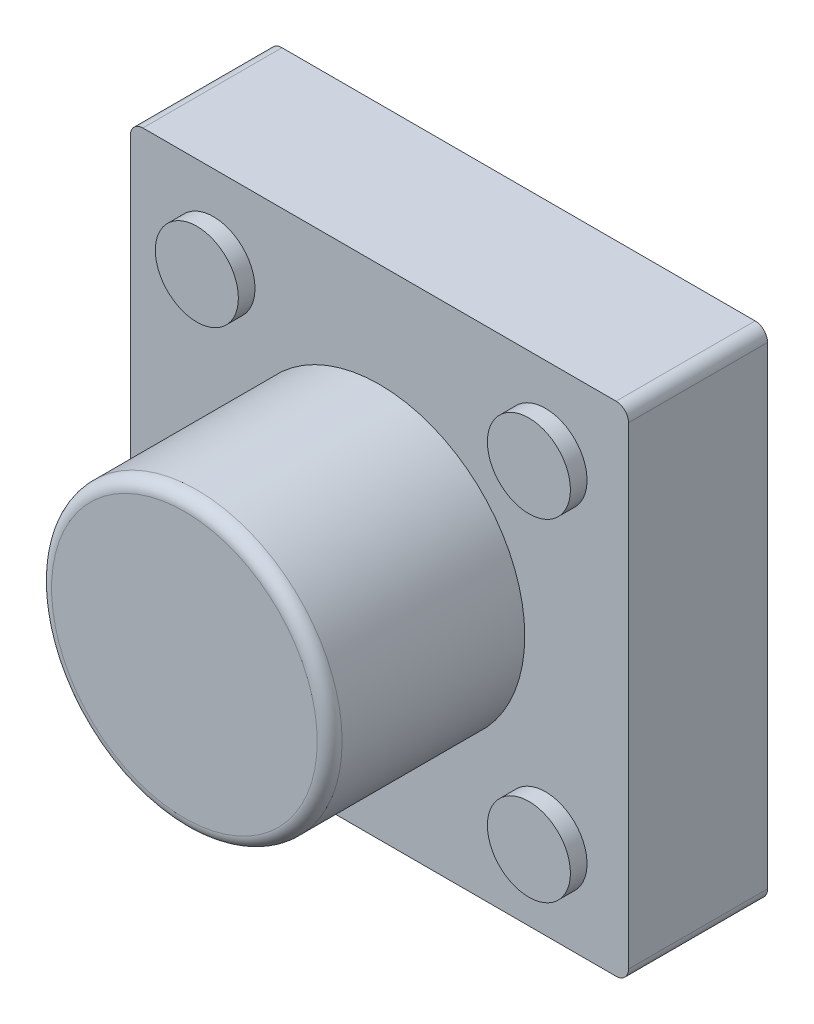
from build123d import *

# Parameters (mm, degrees)
SKETCH2_W           = 12
SKETCH2_H           = 12
BOSS_EXTRUDE1_DEPTH = 3.35
SKETCH3_R           = 3.5
BOSS_EXTRUDE2_DEPTH = 4.7
FILLET1_R           = 0.3
SKETCH5_R           = 1
BOSS_EXTRUDE3_DEPTH = 0.4


with BuildPart() as part:
    # Sketch2 → Boss-Extrude1 (new body)
    with BuildSketch(Plane.XY):
        with Locations((6, 6)):
            Rectangle(SKETCH2_W, SKETCH2_H)
    extrude(amount=BOSS_EXTRUDE1_DEPTH)

    # Sketch3 → Boss-Extrude2 (add)
    with BuildSketch(Plane.XY.offset(3.35)):
        with Locations(Location((6, 6, 0), (0, 0, 180))):
            Circle(SKETCH3_R)
    extrude(amount=BOSS_EXTRUDE2_DEPTH)

    # Fillet1
    fillet1_edges = [part.edges().sort_by_distance(p)[0] for p in [
        (9.5, 6, 8.05),
        (0, 12, 1.675),
        (12, 12, 1.675),
        (12, 0, 1.675),
        (0, 0, 1.675),
    ]]
    fillet(fillet1_edges, radius=FILLET1_R)

    # Sketch5 → Boss-Extrude3 (add)
    with BuildSketch(Plane.XY.offset(3.35)):
        with Locations(Location((2, 10, 0), (0, 0, 180))):
            Circle(SKETCH5_R)
        with Locations(Location((10, 10, 0), (0, 0, 180))):
            Circle(SKETCH5_R)
        with Locations(Location((10, 2, 0), (0, 0, 180))):
            Circle(SKETCH5_R)
        with Locations(Location((2, 2, 0), (0, 0, 180))):
            Circle(SKETCH5_R)
    extrude(amount=BOSS_EXTRUDE3_DEPTH)


solid = part.part
